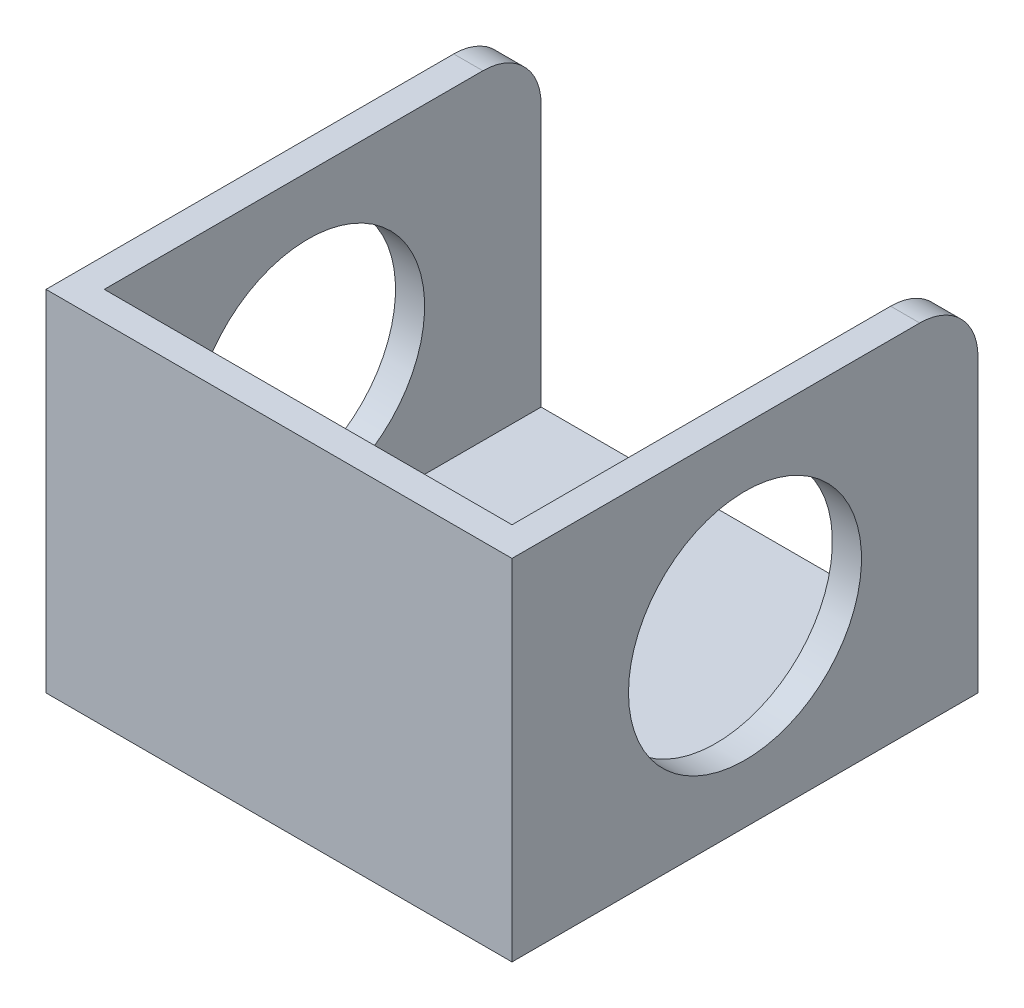
from build123d import *

# Parameters (mm, degrees)
SKETCH1_R           = 101.6
BOSS_EXTRUDE1_DEPTH = 152.4
SHELL1_T            = -12.7
SKETCH2_R           = 22.86
BOSS_EXTRUDE2_DEPTH = 30.48
SKETCH3_R           = 50.8
CUT_EXTRUDE1_DEPTH  = 274.566372202
FILLET1_R           = 25.4
FILLET2_R           = 25.4


with BuildPart() as part:
    # Sketch1 → Boss-Extrude1 (new body)
    with BuildSketch(Plane(origin=(0, 0, 0), x_dir=(1, 0, 0), z_dir=(0, 1, 0))):
        with BuildLine():
            ThreePointArc((101.6, 0), (71.842048938, -71.842048999), (-8.6e-08, -101.6))
            Line((-8.6e-08, -101.6), (101.6, -101.6))
            Line((101.6, -101.6), (101.6, 0))
        make_face()
        with BuildLine():
            ThreePointArc((-7e-08, 101.6), (71.842048944, 71.842048993), (101.6, 0))
            Line((101.6, 0), (101.6, 101.6))
            Line((101.6, 101.6), (-7e-08, 101.6))
        make_face()
        with BuildLine():
            Line((-101.6, 101.6), (-101.6, 8e-08))
            ThreePointArc((-101.6, 8e-08), (-71.842048965, 71.842048972), (-7e-08, 101.6))
            Line((-7e-08, 101.6), (-101.6, 101.6))
        make_face()
        with BuildLine():
            Line((-101.6, 8e-08), (-101.6, -101.6))
            Line((-101.6, -101.6), (-8.6e-08, -101.6))
            ThreePointArc((-8.6e-08, -101.6), (-71.842049028, -71.84204891), (-101.6, 8e-08))
        make_face()
        Circle(SKETCH1_R)
    extrude(amount=BOSS_EXTRUDE1_DEPTH)

    # Shell1
    shell1_openings = [part.faces().sort_by_distance(p)[0] for p in [
        (0, 152.4, 0),
        (0, 76.2, -101.6),
    ]]
    offset(amount=SHELL1_T, openings=shell1_openings, kind=Kind.INTERSECTION)

    # Sketch2 → Boss-Extrude2 (add)
    with BuildSketch(Plane.XZ):
        with Locations(Location((0, 0, 0), (0, 0, 90))):
            Circle(SKETCH2_R)
    extrude(amount=BOSS_EXTRUDE2_DEPTH)

    # Sketch3 → Cut-Extrude1 (cut, through all)
    with BuildSketch(Plane.ZY.offset(101.6)):
        with Locations((0, 76.2)):
            Circle(SKETCH3_R)
    extrude(amount=-CUT_EXTRUDE1_DEPTH, mode=Mode.SUBTRACT)

    # Fillet1
    fillet1_edges = [part.edges().sort_by_distance(p)[0] for p in [
        (-95.25, 152.4, -101.6),
    ]]
    fillet(fillet1_edges, radius=FILLET1_R)

    # Fillet2
    fillet2_edges = [part.edges().sort_by_distance(p)[0] for p in [
        (95.25, 152.4, -101.6),
    ]]
    fillet(fillet2_edges, radius=FILLET2_R)


solid = part.part
